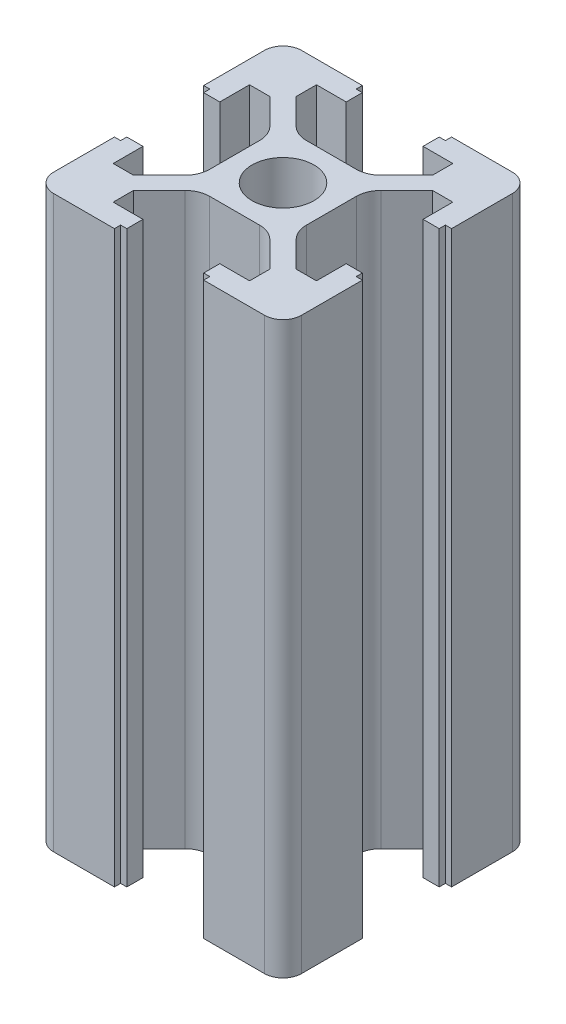
from build123d import *

# Parameters (mm, degrees)
BOSS_EXTRUDE1_DEPTH      = 46
SKETCH4_R                = 2.5
CUT_EXTRUDE2_DEPTH       = 49.124837662
CUT_EXTRUDE1_DEPTH       = 49.124837662
FILLET1_R                = 2
CIRPATTERN1_COUNT        = 4
FILLET1_OF_CIRPATTERN1_R = 2


with BuildPart() as part:
    # Sketch1 → Boss-Extrude1 (new body)
    with BuildSketch(Plane(origin=(0, 0, 0), x_dir=(1, 0, 0), z_dir=(0, 1, 0))):
        with BuildLine():
            Line((8.5, 10), (-8.5, 10))
            ThreePointArc((-8.5, 10), (-9.560660172, 9.560660172), (-10, 8.5))
            Line((-10, 8.5), (-10, -8.5))
            ThreePointArc((-10, -8.5), (-9.560660172, -9.560660172), (-8.5, -10))
            Line((-8.5, -10), (8.5, -10))
            ThreePointArc((8.5, -10), (9.560660172, -9.560660172), (10, -8.5))
            Line((10, -8.5), (10, 8.5))
            ThreePointArc((10, 8.5), (9.560660172, 9.560660172), (8.5, 10))
        make_face()
    extrude(amount=BOSS_EXTRUDE1_DEPTH)

    # Sketch4 → Cut-Extrude2 (cut, through all)
    with BuildSketch(Plane(origin=(0, 0, 0), x_dir=(1, 0, 0), z_dir=(0, 1, 0))):
        with Locations(Location((0, 0, 0), (0, 0, 270))):
            Circle(SKETCH4_R)
    extrude(amount=CUT_EXTRUDE2_DEPTH, mode=Mode.SUBTRACT)

    # Sketch2 → Cut-Extrude1 (cut, through all)
    with BuildSketch(Plane.XZ):
        Polygon((-3.6, -10), (-3.6, -9.5), (-3.1, -9.5), (-3.1, -8.2), (-5.5, -8.2), (-5.5, -6.560660172), (-2.839339828, -3.9), (2.839339828, -3.9), (5.5, -6.560660172), (5.5, -8.2), (3.1, -8.2), (3.1, -9.5), (3.6, -9.5), (3.6, -10), align=None)
    cut_extrude1 = extrude(amount=-CUT_EXTRUDE1_DEPTH, mode=Mode.SUBTRACT)

    # Fillet1
    fillet1_edges = [part.edges().sort_by_distance(p)[0] for p in [
        (-2.839339828, 23, -3.9),
        (2.839339828, 23, -3.9),
    ]]
    fillet(fillet1_edges, radius=FILLET1_R)

    # CirPattern1: Cut-Extrude1 ×4 about axis
    cirpattern1_axis = Axis((0, 0, 0), (0, 1, 0))
    for i in range(1, CIRPATTERN1_COUNT):
        add(cut_extrude1.rotate(cirpattern1_axis, i * 360 / CIRPATTERN1_COUNT), mode=Mode.SUBTRACT)

    # Fillet1 of CirPattern1
    fillet1_of_cirpattern1_edges = [part.edges().sort_by_distance(p)[0] for p in [
        (-3.9, 23, 2.839339828),
        (-3.9, 23, -2.839339828),
        (2.839339828, 23, 3.9),
        (-2.839339828, 23, 3.9),
        (3.9, 23, -2.839339828),
        (3.9, 23, 2.839339828),
    ]]
    fillet(fillet1_of_cirpattern1_edges, radius=FILLET1_OF_CIRPATTERN1_R)


solid = part.part
